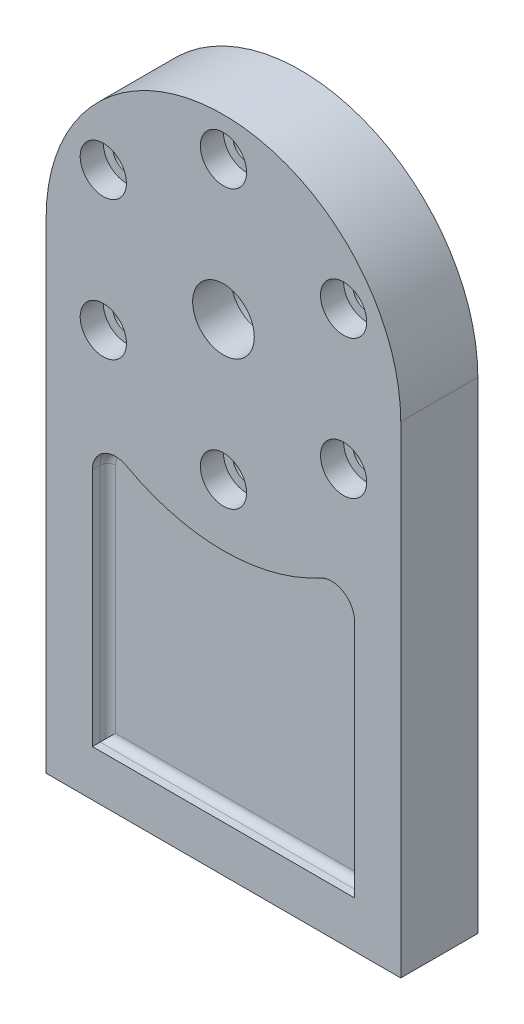
from build123d import *

# Parameters (mm, degrees)
SKETCH1_R                               = 8
BOSS_EXTRUDE1_DEPTH                     = 10
SKETCH4_R                               = 12.5
CUT_EXTRUDE3_DEPTH                      = 10
SKETCH5_R                               = 3.5
CUT_EXTRUDE4_DEPTH                      = 179.204938203
SKETCH6_R                               = 6
CUT_EXTRUDE5_DEPTH                      = 6
CIRPATTERN1_COUNT                       = 6
CUT_EXTRUDE6_DEPTH                      = 4
FILLET1_R                               = 2
FILLET1_OF_MIRROR1_R                    = 2
TAP_DRILL_FOR_M10X1_25_TAP2_D           = 8.8
TAP_DRILL_FOR_M10X1_25_TAP2_DEPTH       = 24
TAP_DRILL_FOR_M10X1_25_TAP2_CSINK_D     = 8.85
TAP_DRILL_FOR_M10X1_25_TAP2_CSINK_ANGLE = 90
TAP_DRILL_FOR_M10X1_25_TAP2_TIP         = 2.643786724


with BuildPart() as part:
    # Sketch1 → Boss-Extrude1 (new, symmetric)
    with BuildSketch(Plane.XY):
        with BuildLine():
            Line((46, 125), (46, 0))
            Line((46, 0), (-46, 0))
            Line((-46, 0), (-46, 125))
            ThreePointArc((-46, 125), (0, 171), (46, 125))
        make_face()
        with Locations((0, 125)):
            Circle(SKETCH1_R, mode=Mode.SUBTRACT)
    extrude(amount=BOSS_EXTRUDE1_DEPTH, both=True)

    # Sketch4 → Cut-Extrude3 (cut)
    with BuildSketch(Plane(origin=(0, 0, -10), x_dir=(-1, 0, 0), z_dir=(0, 0, -1))):
        with Locations((0, 125)):
            Circle(SKETCH4_R)
    extrude(amount=-CUT_EXTRUDE3_DEPTH, mode=Mode.SUBTRACT)

    # Sketch5 → Cut-Extrude4 (cut, through all)
    with BuildSketch(Plane(origin=(0, 0, -10), x_dir=(-1, 0, 0), z_dir=(0, 0, -1))):
        with Locations((0, 161)):
            Circle(SKETCH5_R)
    cut_extrude4 = extrude(amount=-CUT_EXTRUDE4_DEPTH, mode=Mode.SUBTRACT)

    # Sketch6 → Cut-Extrude5 (cut)
    with BuildSketch(Plane.XY.offset(10)):
        with Locations((0, 161)):
            Circle(SKETCH6_R)
    cut_extrude5 = extrude(amount=-CUT_EXTRUDE5_DEPTH, mode=Mode.SUBTRACT)

    # CirPattern1: Cut-Extrude4, Cut-Extrude5 ×6 about axis
    cirpattern1_axis = Axis((0, 125, 0), (0, 0, 1))
    add([cut_extrude4.rotate(cirpattern1_axis, i * 360 / CIRPATTERN1_COUNT) for i in range(1, CIRPATTERN1_COUNT)], mode=Mode.SUBTRACT)
    add([cut_extrude5.rotate(cirpattern1_axis, i * 360 / CIRPATTERN1_COUNT) for i in range(1, CIRPATTERN1_COUNT)], mode=Mode.SUBTRACT)

    # Sketch9 → Cut-Extrude6 (cut)
    with BuildSketch(Plane(origin=(0, 0, -10), x_dir=(-1, 0, 0), z_dir=(0, 0, -1))):
        with BuildLine():
            Line((-34, 12), (-34, 74.206299603))
            ThreePointArc((-34, 74.206299603), (-31.051285766, 79.372502771), (-25.103448276, 79.460820334))
            ThreePointArc((-25.103448276, 79.460820334), (0, 73), (25.103448276, 79.460820334))
            ThreePointArc((25.103448276, 79.460820334), (31.051285766, 79.372502771), (34, 74.206299603))
            Line((34, 74.206299603), (34, 12))
            Line((34, 12), (-34, 12))
        make_face()
    cut_extrude6 = extrude(amount=-CUT_EXTRUDE6_DEPTH, mode=Mode.SUBTRACT)

    # Fillet1
    fillet1_edges = [part.edges().sort_by_distance(p)[0] for p in [
        (-31.051285766, 79.372502771, -6),
        (-34, 43.103149802, -6),
        (0, 12, -6),
        (34, 43.103149802, -6),
        (31.051285766, 79.372502771, -6),
        (0, 73, -6),
    ]]
    fillet(fillet1_edges, radius=FILLET1_R)

    # Mirror1: Cut-Extrude6 across plane
    add(cut_extrude6.mirror(Plane.XY), mode=Mode.SUBTRACT)

    # Fillet1 of Mirror1
    fillet1_of_mirror1_edges = [part.edges().sort_by_distance(p)[0] for p in [
        (-31.051285766, 79.372502771, 6),
        (-34, 43.103149802, 6),
        (0, 12, 6),
        (34, 43.103149802, 6),
        (31.051285766, 79.372502771, 6),
        (0, 73, 6),
    ]]
    fillet(fillet1_of_mirror1_edges, radius=FILLET1_OF_MIRROR1_R)

    # Tap Drill for M10x1.25 Tap2
    with Locations(Plane(origin=(0, 0, 0), x_dir=(-1, 0, 0), z_dir=(0, -1, 0))):
        with Locations((-30, 0), (30, 0)):
            CounterSinkHole(TAP_DRILL_FOR_M10X1_25_TAP2_D / 2, TAP_DRILL_FOR_M10X1_25_TAP2_CSINK_D / 2, depth=TAP_DRILL_FOR_M10X1_25_TAP2_DEPTH, counter_sink_angle=TAP_DRILL_FOR_M10X1_25_TAP2_CSINK_ANGLE)
            with Locations((0, 0, -(TAP_DRILL_FOR_M10X1_25_TAP2_DEPTH + TAP_DRILL_FOR_M10X1_25_TAP2_TIP / 2))):  # 118° drill point
                Cone(0, TAP_DRILL_FOR_M10X1_25_TAP2_D / 2, TAP_DRILL_FOR_M10X1_25_TAP2_TIP, mode=Mode.SUBTRACT)


solid = part.part
